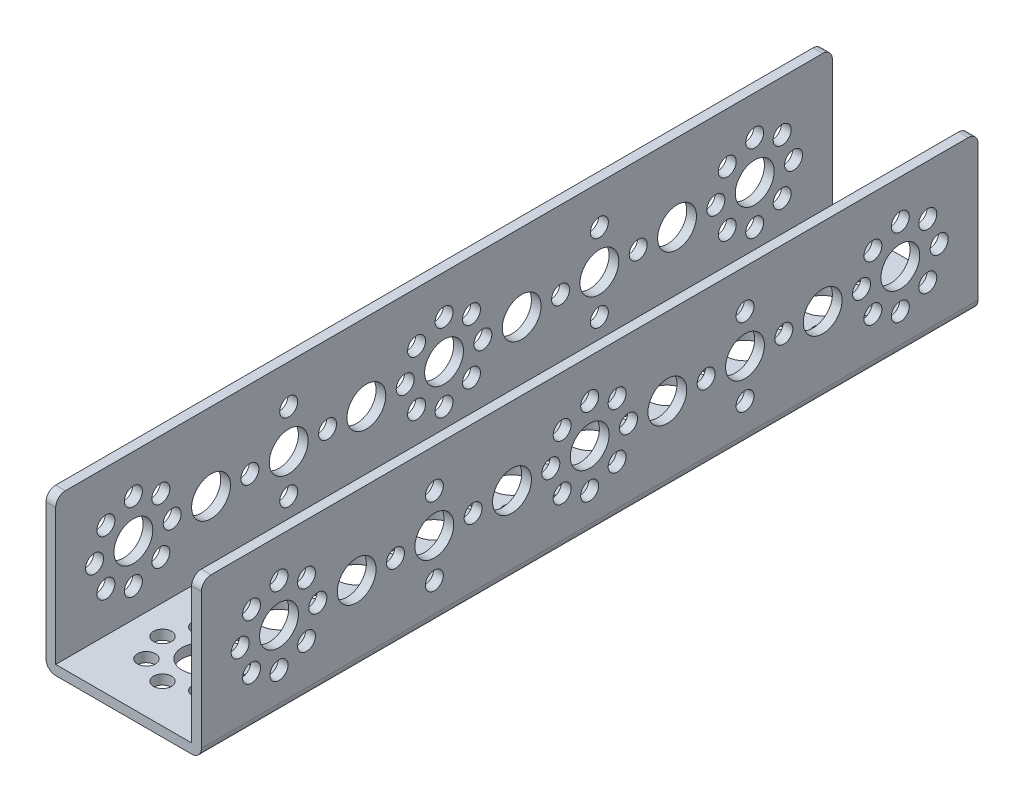
from build123d import *

# Parameters (mm, degrees)
BOSS_EXTRUDE1_DEPTH = 80
SKETCH2_R           = 4
SKETCH2_R_2         = 1.85
CUT_EXTRUDE1_DEPTH  = 92.913002345
SKETCH5_R           = 4
SKETCH5_R_2         = 1.85
CUT_EXTRUDE2_DEPTH  = 2
FILLET1_R           = 2


with BuildPart() as part:
    # Sketch1 → Boss-Extrude1 (new, symmetric)
    with BuildSketch(Plane.XY):
        with BuildLine():
            Line((-14, 0), (14, 0))
            ThreePointArc((14, 0), (15.414213562, 0.585786438), (16, 2))
            Line((16, 2), (16, 32))
            Line((16, 32), (14, 32))
            Line((14, 32), (14, 2))
            Line((14, 2), (-14, 2))
            Line((-14, 2), (-14, 32))
            Line((-14, 32), (-16, 32))
            Line((-16, 32), (-16, 2))
            ThreePointArc((-16, 2), (-15.414213562, 0.585786438), (-14, 0))
        make_face()
    extrude(amount=BOSS_EXTRUDE1_DEPTH, both=True)

    # Sketch2 → Cut-Extrude1 (cut, through all)
    with BuildSketch(Plane(origin=(16, 0, 0), x_dir=(0, 0, -1), z_dir=(1, 0, 0))):
        with Locations((-32, 16)):
            Circle(SKETCH2_R)
        with Locations((-24, 16)):
            Circle(SKETCH2_R_2)
        with Locations((-40, 16)):
            Circle(SKETCH2_R_2)
        with Locations((-32, 8)):
            Circle(SKETCH2_R_2)
        with Locations((-32, 24)):
            Circle(SKETCH2_R_2)
        with Locations((-48, 16)):
            Circle(SKETCH2_R)
        with Locations((-16, 16)):
            Circle(SKETCH2_R)
        with Locations((16, 16)):
            Circle(SKETCH2_R)
        with Locations((48, 16)):
            Circle(SKETCH2_R)
        with Locations((-58.343145751, 21.656854249)):
            Circle(SKETCH2_R_2)
        with Locations((-64, 24)):
            Circle(SKETCH2_R_2)
        with Locations((-69.656854249, 21.656854249)):
            Circle(SKETCH2_R_2)
        with Locations((-64, 16)):
            Circle(SKETCH2_R)
        with Locations((-56, 16)):
            Circle(SKETCH2_R_2)
        with Locations((-72, 16)):
            Circle(SKETCH2_R_2)
        with Locations((-64, 8)):
            Circle(SKETCH2_R_2)
        with Locations((-58.343145751, 10.343145751)):
            Circle(SKETCH2_R_2)
        with Locations((-69.656854249, 10.343145751)):
            Circle(SKETCH2_R_2)
        with Locations((32, 16)):
            Circle(SKETCH2_R)
        with Locations((40, 16)):
            Circle(SKETCH2_R_2)
        with Locations((24, 16)):
            Circle(SKETCH2_R_2)
        with Locations((32, 8)):
            Circle(SKETCH2_R_2)
        with Locations((32, 24)):
            Circle(SKETCH2_R_2)
        with Locations((64, 16)):
            Circle(SKETCH2_R)
        with Locations((72, 16)):
            Circle(SKETCH2_R_2)
        with Locations((56, 16)):
            Circle(SKETCH2_R_2)
        with Locations((64, 8)):
            Circle(SKETCH2_R_2)
        with Locations((64, 24)):
            Circle(SKETCH2_R_2)
        with Locations((58.343145751, 21.656854249)):
            Circle(SKETCH2_R_2)
        with Locations((69.656854249, 21.656854249)):
            Circle(SKETCH2_R_2)
        with Locations((69.656854249, 10.343145751)):
            Circle(SKETCH2_R_2)
        with Locations((58.343145751, 10.343145751)):
            Circle(SKETCH2_R_2)
        with Locations((0, 16)):
            Circle(SKETCH2_R)
        with Locations((8, 16)):
            Circle(SKETCH2_R_2)
        with Locations((-8, 16)):
            Circle(SKETCH2_R_2)
        with Locations((0, 8)):
            Circle(SKETCH2_R_2)
        with Locations((0, 24)):
            Circle(SKETCH2_R_2)
        with Locations((-5.656854249, 21.656854249)):
            Circle(SKETCH2_R_2)
        with Locations((5.656854249, 21.656854249)):
            Circle(SKETCH2_R_2)
        with Locations((5.656854249, 10.343145751)):
            Circle(SKETCH2_R_2)
        with Locations((-5.656854249, 10.343145751)):
            Circle(SKETCH2_R_2)
    extrude(amount=-CUT_EXTRUDE1_DEPTH, mode=Mode.SUBTRACT)

    # Sketch5 → Cut-Extrude2 (cut)
    with BuildSketch(Plane.XZ):
        with Locations(Location((0, -32, 0), (0, 0, 270))):
            Circle(SKETCH5_R)
        with Locations(Location((0, -24, 0), (0, 0, 270))):
            Circle(SKETCH5_R_2)
        with Locations(Location((0, -40, 0), (0, 0, 270))):
            Circle(SKETCH5_R_2)
        with Locations(Location((8, -32, 0), (0, 0, 270))):
            Circle(SKETCH5_R_2)
        with Locations(Location((-8, -32, 0), (0, 0, 270))):
            Circle(SKETCH5_R_2)
        with Locations(Location((0, -48, 0), (0, 0, 270))):
            Circle(SKETCH5_R)
        with Locations(Location((0, -16, 0), (0, 0, 270))):
            Circle(SKETCH5_R)
        with Locations(Location((0, 16, 0), (0, 0, 270))):
            Circle(SKETCH5_R)
        with Locations(Location((0, 48, 0), (0, 0, 270))):
            Circle(SKETCH5_R)
        with Locations(Location((-5.656854249, -58.343145751, 0), (0, 0, 270))):
            Circle(SKETCH5_R_2)
        with Locations(Location((-8, -64, 0), (0, 0, 270))):
            Circle(SKETCH5_R_2)
        with Locations(Location((-5.656854249, -69.656854249, 0), (0, 0, 270))):
            Circle(SKETCH5_R_2)
        with Locations(Location((0, -64, 0), (0, 0, 270))):
            Circle(SKETCH5_R)
        with Locations(Location((0, -56, 0), (0, 0, 270))):
            Circle(SKETCH5_R_2)
        with Locations(Location((0, -72, 0), (0, 0, 270))):
            Circle(SKETCH5_R_2)
        with Locations(Location((8, -64, 0), (0, 0, 270))):
            Circle(SKETCH5_R_2)
        with Locations(Location((5.656854249, -58.343145751, 0), (0, 0, 270))):
            Circle(SKETCH5_R_2)
        with Locations(Location((5.656854249, -69.656854249, 0), (0, 0, 270))):
            Circle(SKETCH5_R_2)
        with Locations(Location((0, 32, 0), (0, 0, 270))):
            Circle(SKETCH5_R)
        with Locations(Location((0, 40, 0), (0, 0, 270))):
            Circle(SKETCH5_R_2)
        with Locations(Location((0, 24, 0), (0, 0, 270))):
            Circle(SKETCH5_R_2)
        with Locations(Location((8, 32, 0), (0, 0, 270))):
            Circle(SKETCH5_R_2)
        with Locations(Location((-8, 32, 0), (0, 0, 270))):
            Circle(SKETCH5_R_2)
        with Locations(Location((0, 64, 0), (0, 0, 270))):
            Circle(SKETCH5_R)
        with Locations(Location((0, 72, 0), (0, 0, 270))):
            Circle(SKETCH5_R_2)
        with Locations(Location((0, 56, 0), (0, 0, 270))):
            Circle(SKETCH5_R_2)
        with Locations(Location((8, 64, 0), (0, 0, 270))):
            Circle(SKETCH5_R_2)
        with Locations(Location((-8, 64, 0), (0, 0, 270))):
            Circle(SKETCH5_R_2)
        with Locations(Location((-5.656854249, 58.343145751, 0), (0, 0, 270))):
            Circle(SKETCH5_R_2)
        with Locations(Location((-5.656854249, 69.656854249, 0), (0, 0, 270))):
            Circle(SKETCH5_R_2)
        with Locations(Location((5.656854249, 69.656854249, 0), (0, 0, 270))):
            Circle(SKETCH5_R_2)
        with Locations(Location((5.656854249, 58.343145751, 0), (0, 0, 270))):
            Circle(SKETCH5_R_2)
        with Locations(Location((0, 0, 0), (0, 0, 270))):
            Circle(SKETCH5_R)
        with Locations(Location((0, 8, 0), (0, 0, 270))):
            Circle(SKETCH5_R_2)
        with Locations(Location((0, -8, 0), (0, 0, 270))):
            Circle(SKETCH5_R_2)
        with Locations(Location((8, 0, 0), (0, 0, 270))):
            Circle(SKETCH5_R_2)
        with Locations(Location((-8, 0, 0), (0, 0, 270))):
            Circle(SKETCH5_R_2)
        with Locations(Location((-5.656854249, -5.656854249, 0), (0, 0, 270))):
            Circle(SKETCH5_R_2)
        with Locations(Location((-5.656854249, 5.656854249, 0), (0, 0, 270))):
            Circle(SKETCH5_R_2)
        with Locations(Location((5.656854249, 5.656854249, 0), (0, 0, 270))):
            Circle(SKETCH5_R_2)
        with Locations(Location((5.656854249, -5.656854249, 0), (0, 0, 270))):
            Circle(SKETCH5_R_2)
    extrude(amount=-CUT_EXTRUDE2_DEPTH, mode=Mode.SUBTRACT)

    # Fillet1
    fillet1_edges = [part.edges().sort_by_distance(p)[0] for p in [
        (15, 32, 80),
        (15, 32, -80),
        (-15, 32, -80),
        (-15, 32, 80),
    ]]
    fillet(fillet1_edges, radius=FILLET1_R)


solid = part.part
